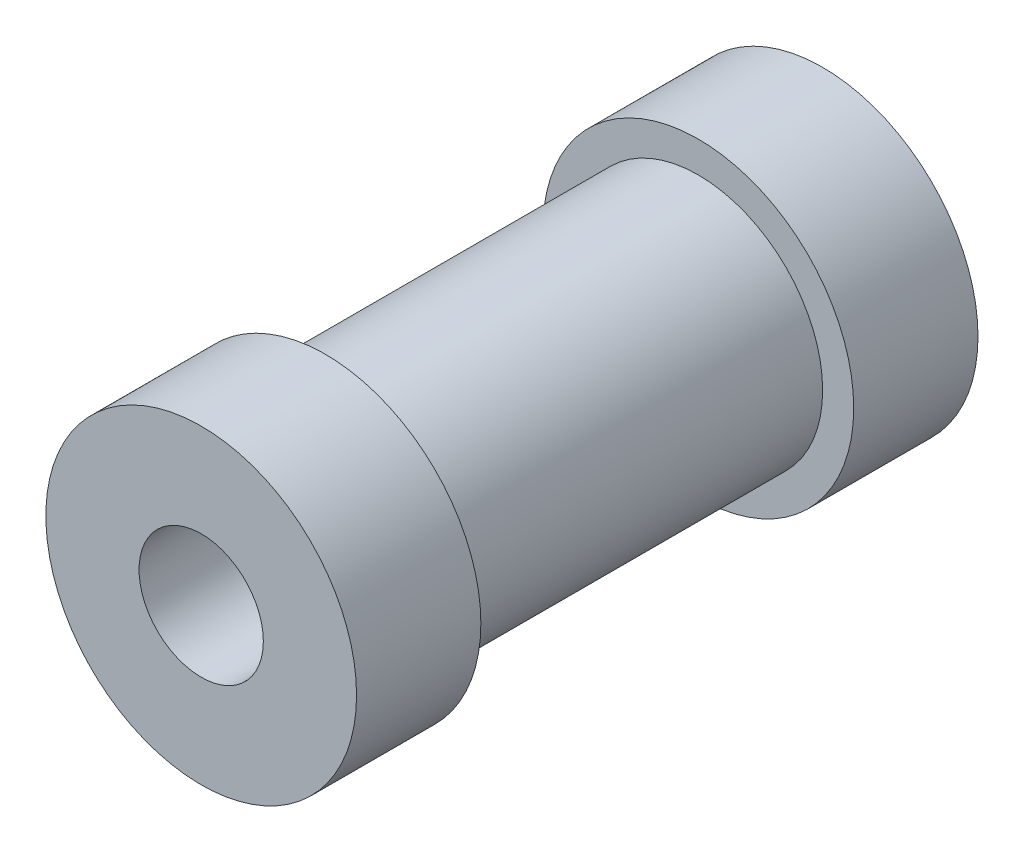
from build123d import *

# Parameters (mm, degrees)
SKETCH1_R               = 1
BOSS_EXTRUDE1_DEPTH     = 1.5
SKETCH2_R               = 1.25
BOSS_EXTRUDE2_DEPTH     = 1
CUT_EXTRUDE1_DEPTH      = 4.061862178
CUT_EXTRUDE1_DEPTH_BACK = 4.061862178
SKETCH1_4_R             = 0.5


with BuildPart() as part:
    # Sketch1 → Boss-Extrude1 (new, symmetric)
    with BuildSketch(Plane.XY):
        Circle(SKETCH1_R)
    extrude(amount=BOSS_EXTRUDE1_DEPTH, both=True)

    # Sketch2 → Boss-Extrude2 (add)
    with BuildSketch(Plane.XY.offset(1.5)):
        Circle(SKETCH2_R)
    boss_extrude2 = extrude(amount=BOSS_EXTRUDE2_DEPTH)

    # Mirror1: Boss-Extrude2 across plane
    add(boss_extrude2.mirror(Plane.XY))

    # Sketch1<4> → Cut-Extrude1 (cut, two sides: drawn at the far end of the back side and taken through both)
    with BuildSketch(Plane.XY.offset(-CUT_EXTRUDE1_DEPTH_BACK)):
        Circle(SKETCH1_4_R)
    extrude(amount=CUT_EXTRUDE1_DEPTH + CUT_EXTRUDE1_DEPTH_BACK, mode=Mode.SUBTRACT)


solid = part.part
